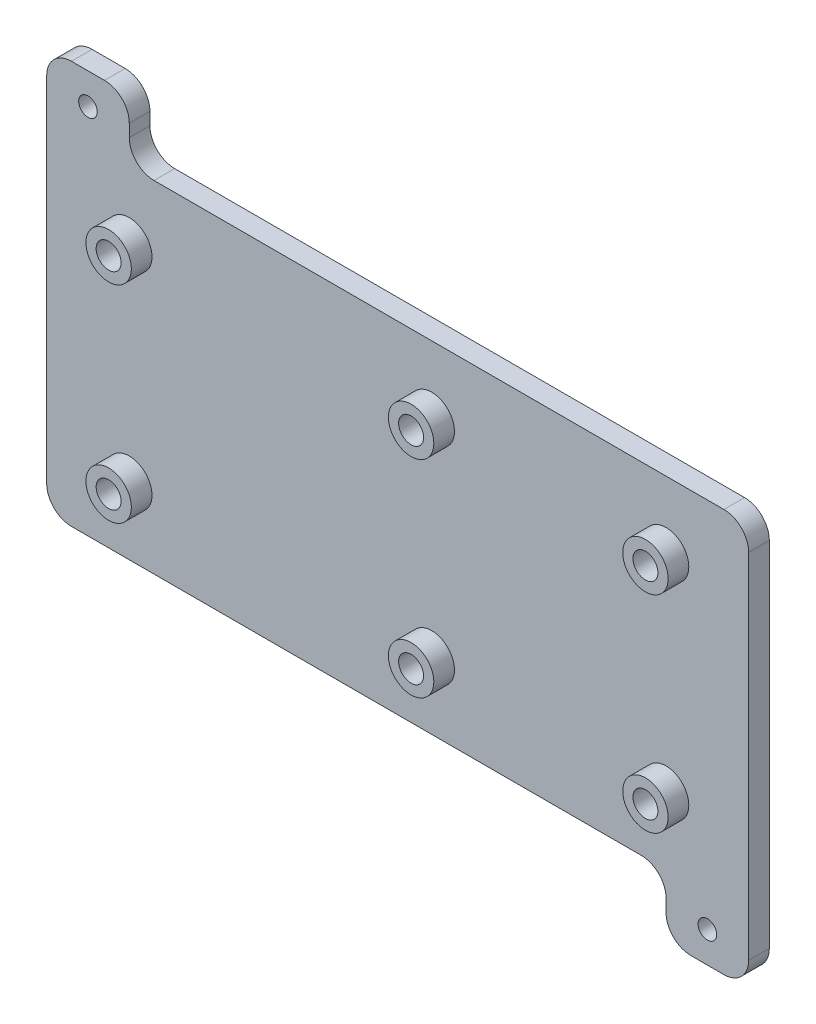
from build123d import *

# Parameters (mm, degrees)
SKETCH1_W            = 170
SKETCH1_H            = 82.55
BOSS_EXTRUDE1_DEPTH  = 5
SKETCH2_R            = 5.5
SKETCH2_R_2          = 3.025
BOSS_EXTRUDE2_DEPTH  = 5
BOSS_EXTRUDE3_DEPTH  = 5
FILLET1_R            = 6
M4_CLEARANCE_HOLE1_D = 4.5


with BuildPart() as part:
    # Sketch1 → Boss-Extrude1 (new body)
    with BuildSketch(Plane.XY):
        Rectangle(SKETCH1_W, SKETCH1_H)
    extrude(amount=BOSS_EXTRUDE1_DEPTH)

    # Sketch2 → Boss-Extrude2 (add)
    # profile 1 of 6: a face of its own
    with BuildSketch(Plane.XY.offset(5)):
        with Locations((65, 25)):
            Circle(SKETCH2_R)
        with Locations((65, 25)):
            Circle(SKETCH2_R_2, mode=Mode.SUBTRACT)
    # profile 2 of 6: a face of its own
    with BuildSketch(Plane.XY.offset(5)):
        with Locations((8.25, 25)):
            Circle(SKETCH2_R)
        with Locations((8.25, 25)):
            Circle(SKETCH2_R_2, mode=Mode.SUBTRACT)
    # profile 3 of 6: a face of its own
    with BuildSketch(Plane.XY.offset(5)):
        with Locations((-65, 25)):
            Circle(SKETCH2_R)
        with Locations((-65, 25)):
            Circle(SKETCH2_R_2, mode=Mode.SUBTRACT)
    # profile 4 of 6: a face of its own
    with BuildSketch(Plane.XY.offset(5)):
        with Locations((-65, -25)):
            Circle(SKETCH2_R)
        with Locations((-65, -25)):
            Circle(SKETCH2_R_2, mode=Mode.SUBTRACT)
    # profile 5 of 6: a face of its own
    with BuildSketch(Plane.XY.offset(5)):
        with Locations((8.25, -25)):
            Circle(SKETCH2_R)
        with Locations((8.25, -25)):
            Circle(SKETCH2_R_2, mode=Mode.SUBTRACT)
    # profile 6 of 6: a face of its own
    with BuildSketch(Plane.XY.offset(5)):
        with Locations((65, -25)):
            Circle(SKETCH2_R)
        with Locations((65, -25)):
            Circle(SKETCH2_R_2, mode=Mode.SUBTRACT)
    extrude(amount=BOSS_EXTRUDE2_DEPTH)

    # Sketch3 → Boss-Extrude3 (add)
    with BuildSketch(Plane.XY.offset(5)):
        Polygon((-65, 56.275), (-85, 41.275), (-85, 56.275), align=None)
        Polygon((-65, 56.275), (-85, 41.275), (-65, 41.275), align=None)
        Polygon((65, -56.275), (85, -41.275), (65, -41.275), align=None)
        Polygon((85, -41.275), (85, -56.275), (65, -56.275), align=None)
    extrude(amount=-BOSS_EXTRUDE3_DEPTH)

    # Fillet1
    fillet1_edges = [part.edges().sort_by_distance(p)[0] for p in [
        (-85, 56.275, 2.5),
        (-65, 56.275, 2.5),
        (-65, 41.275, 2.5),
        (65, -56.275, 2.5),
        (65, -41.275, 2.5),
        (85, -56.275, 2.5),
        (-85, -41.275, 2.5),
        (85, 41.275, 2.5),
    ]]
    fillet(fillet1_edges, radius=FILLET1_R)

    # M4 Clearance Hole1 (through all)
    with Locations(Plane.XY.offset(5)):
        with Locations((-75, 48.775), (75, -48.775)):
            Hole(M4_CLEARANCE_HOLE1_D / 2)


solid = part.part
